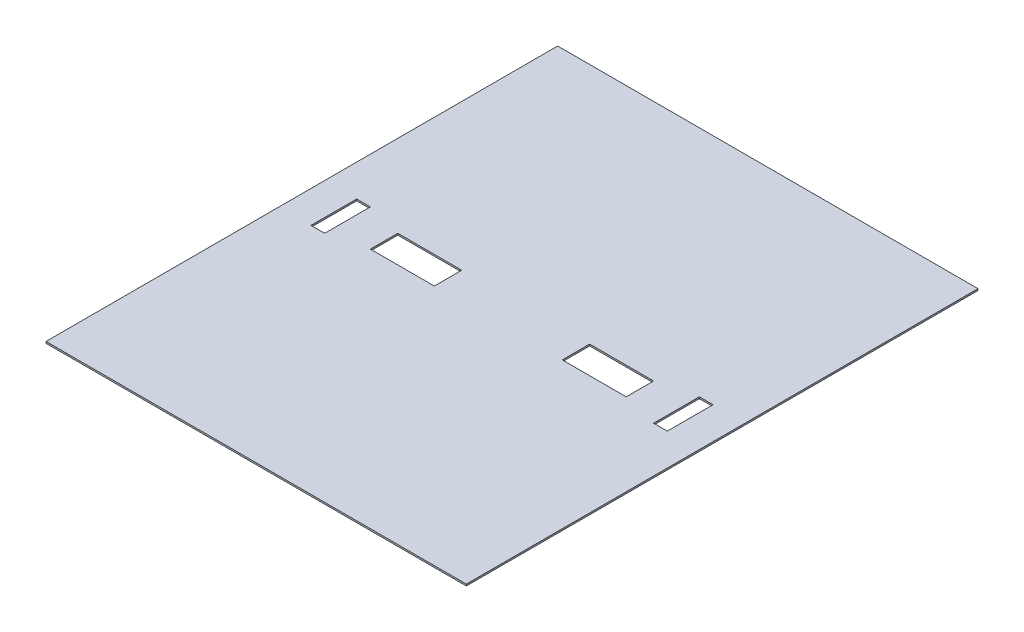
from build123d import *

# Parameters (mm, degrees)
SKETCH1_W           = 584.2
SKETCH1_H           = 711.2
BOSS_EXTRUDE1_DEPTH = 2.286
SKETCH3_W           = 19.05
SKETCH3_H           = 63.5
SKETCH3_W_2         = 88.9
SKETCH3_H_2         = 38.1
CUT_EXTRUDE1_DEPTH  = 461.19451952


with BuildPart() as part:
    # Sketch1 → Boss-Extrude1 (new body)
    with BuildSketch(Plane(origin=(0, -25.4, 330.2), x_dir=(1, 0, 0), z_dir=(0, 1, 0))):
        with Locations((0, 330.2)):
            Rectangle(SKETCH1_W, SKETCH1_H)
    extrude(amount=-BOSS_EXTRUDE1_DEPTH)

    # Sketch3 → Cut-Extrude1 (cut, through all)
    with BuildSketch(Plane(origin=(0, -27.686, 0), x_dir=(-1, 0, 0), z_dir=(0, -1, 0))):
        with Locations((238.125, 0)):
            Rectangle(SKETCH3_W, SKETCH3_H)
        with Locations((133.35, 0)):
            Rectangle(SKETCH3_W_2, SKETCH3_H_2)
    cut_extrude1 = extrude(amount=-CUT_EXTRUDE1_DEPTH, mode=Mode.SUBTRACT)

    # Mirror1: Cut-Extrude1 across plane
    add(cut_extrude1.mirror(Plane(origin=(0, 0, 0), x_dir=(0, 0, 1), z_dir=(1, 0, 0))), mode=Mode.SUBTRACT)


solid = part.part
